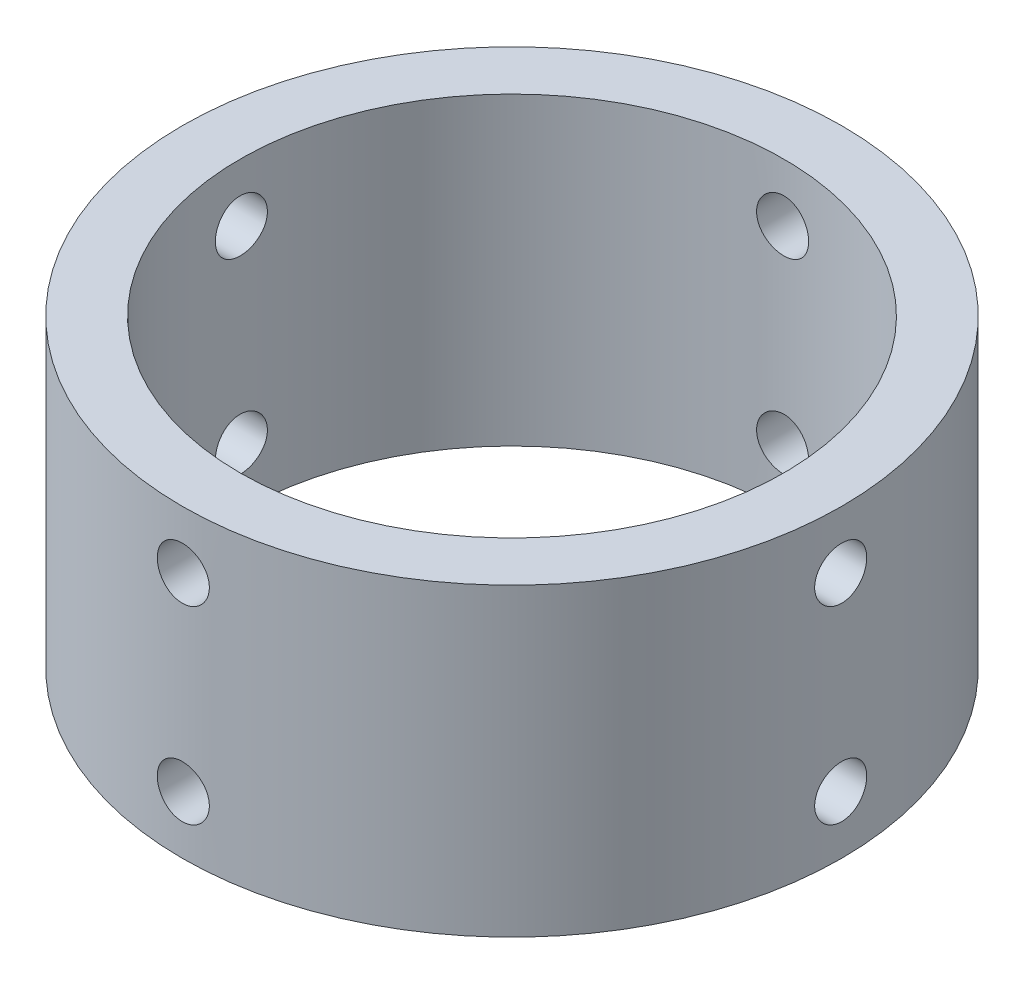
from build123d import *

# Parameters (mm, degrees)
SKETCH1_R           = 28.5
SKETCH1_R_2         = 23.5
BOSS_EXTRUDE1_DEPTH = 13.175
SKETCH2_R           = 2.25
CUT_EXTRUDE1_DEPTH  = 43.403780787
CIRPATTERN1_COUNT   = 4


with BuildPart() as part:
    # Sketch1 → Boss-Extrude1 (new, symmetric)
    with BuildSketch(Plane(origin=(0, 0, 0), x_dir=(1, 0, 0), z_dir=(0, 1, 0))):
        with Locations(Location((0, 0, 0), (0, 0, 90))):
            Circle(SKETCH1_R)
        with Locations(Location((0, 0, 0), (0, 0, 90))):
            Circle(SKETCH1_R_2, mode=Mode.SUBTRACT)
    extrude(amount=BOSS_EXTRUDE1_DEPTH, both=True)

    # Sketch2 → Cut-Extrude1 (cut, through all)
    with BuildSketch(Plane.XY):
        with Locations(Location((0, 8.175, 0), (0, 0, 90))):
            Circle(SKETCH2_R)
        with Locations(Location((0, -8.175, 0), (0, 0, 90))):
            Circle(SKETCH2_R)
    cut_extrude1 = extrude(amount=-CUT_EXTRUDE1_DEPTH, mode=Mode.SUBTRACT)

    # CirPattern1: Cut-Extrude1 ×4 about axis
    cirpattern1_axis = Axis((0, 13.175, 0), (0, -1, 0))
    for i in range(1, CIRPATTERN1_COUNT):
        add(cut_extrude1.rotate(cirpattern1_axis, i * 360 / CIRPATTERN1_COUNT), mode=Mode.SUBTRACT)


solid = part.part
